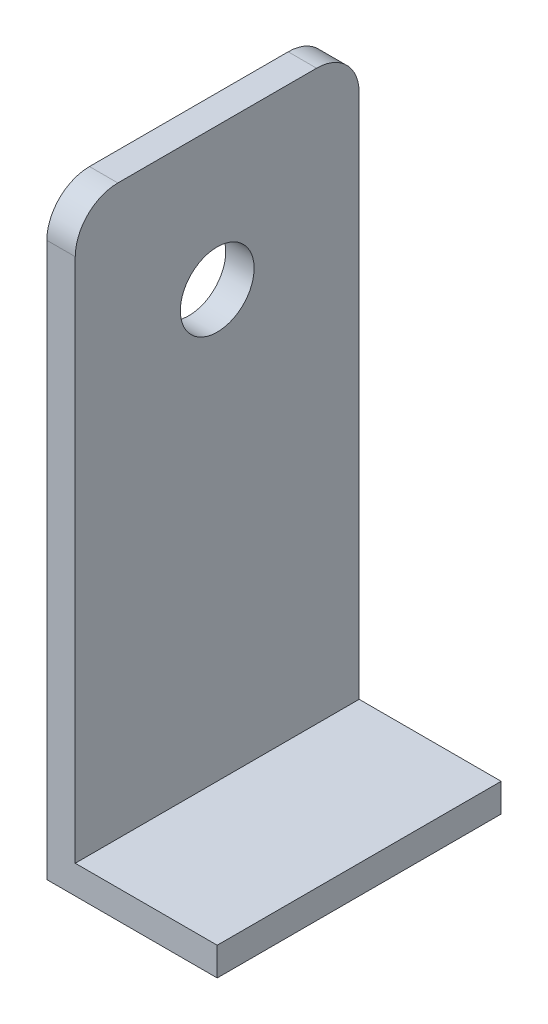
from build123d import *

# Parameters (mm, degrees)
EXTRUDE_1_DEPTH     = 20
SKETCH_2_R          = 2.6
CUT_EXTRUDE_1_DEPTH = 10
FILLET_1_R          = 3


with BuildPart() as part:
    # 草图1 → 拉伸-薄壁1 (new body)
    with BuildSketch(Plane.XY):
        Polygon((0, 40), (0, 0), (10, 0), (10, -2), (-2, -2), (-2, 40), align=None)
    extrude(amount=EXTRUDE_1_DEPTH)

    # 草图2 → 切除-拉伸1 (cut)
    with BuildSketch(Plane(origin=(0, 0, 0), x_dir=(0, 0, -1), z_dir=(1, 0, 0))):
        with Locations((-10, 30)):
            Circle(SKETCH_2_R)
    extrude(amount=-CUT_EXTRUDE_1_DEPTH, mode=Mode.SUBTRACT)

    # 圆角1
    fillet_1_edges = [part.edges().sort_by_distance(p)[0] for p in [
        (-1, 40, 20),
        (-1, 40, 0),
    ]]
    fillet(fillet_1_edges, radius=FILLET_1_R)


solid = part.part
